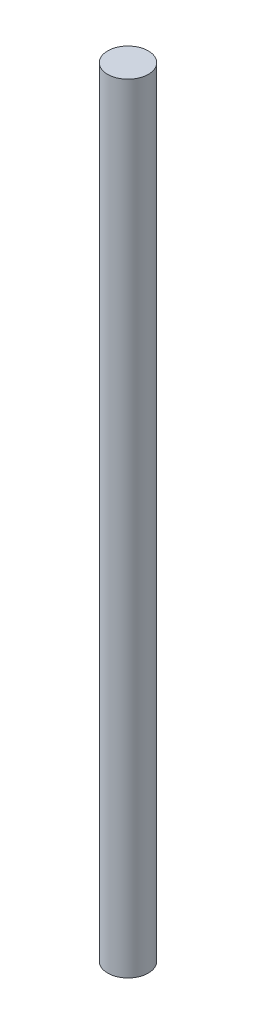
from build123d import *

# Parameters (mm, degrees)
SKETCH1_R           = 6.35
BOSS_EXTRUDE1_DEPTH = 121.5


with BuildPart() as part:
    # Sketch1 → Boss-Extrude1 (new, symmetric)
    with BuildSketch(Plane(origin=(0, 0, 0), x_dir=(1, 0, 0), z_dir=(0, 1, 0))):
        with Locations(Location((0, 0, 0), (0, 0, 270))):
            Circle(SKETCH1_R)
    extrude(amount=BOSS_EXTRUDE1_DEPTH, both=True)


solid = part.part
